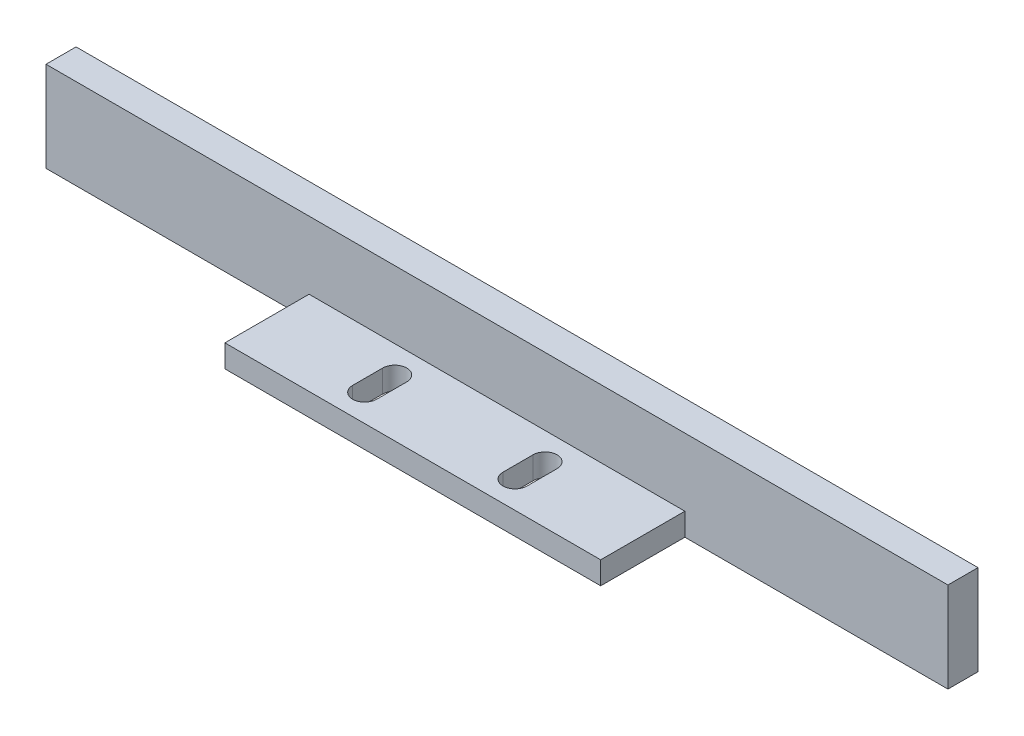
from build123d import *

# Parameters (mm, degrees)
SKETCH1_W           = 120
SKETCH1_H           = 12
BOSS_EXTRUDE1_DEPTH = 4
BOSS_EXTRUDE2_DEPTH = 11.2
CUT_EXTRUDE1_DEPTH  = 3


with BuildPart() as part:
    # Sketch1 → Boss-Extrude1 (new body)
    with BuildSketch(Plane.XY):
        with Locations((-3.767369491, 28.596547675)):
            Rectangle(SKETCH1_W, SKETCH1_H)
    extrude(amount=BOSS_EXTRUDE1_DEPTH)

    # Sketch2 → Boss-Extrude2 (add)
    with BuildSketch(Plane.XY.offset(4)):
        Polygon((-3.767369491, 22.596547675), (21.232630509, 22.596547675), (21.232630509, 25.596547675), (-28.767369491, 25.596547675), (-28.767369491, 22.596547675), align=None)
    extrude(amount=BOSS_EXTRUDE2_DEPTH)

    # Sketch3 → Cut-Extrude1 (cut)
    with BuildSketch(Plane(origin=(0, 25.596547675, 0), x_dir=(1, 0, 0), z_dir=(0, 1, 0))):
        with BuildLine():
            Line((7.832630509, -11.6), (7.832630509, -7.6))
            ThreePointArc((7.832630509, -7.6), (6.232630509, -6), (4.632630509, -7.6))
            Line((4.632630509, -7.6), (4.632630509, -11.6))
            ThreePointArc((4.632630509, -11.6), (6.232630509, -13.2), (7.832630509, -11.6))
        make_face()
        with BuildLine():
            Line((-15.367369491, -7.6), (-15.367369491, -11.6))
            ThreePointArc((-15.367369491, -11.6), (-13.767369491, -13.2), (-12.167369491, -11.6))
            Line((-12.167369491, -11.6), (-12.167369491, -7.6))
            ThreePointArc((-12.167369491, -7.6), (-13.767369491, -6), (-15.367369491, -7.6))
        make_face()
    extrude(amount=-CUT_EXTRUDE1_DEPTH, mode=Mode.SUBTRACT)


solid = part.part
